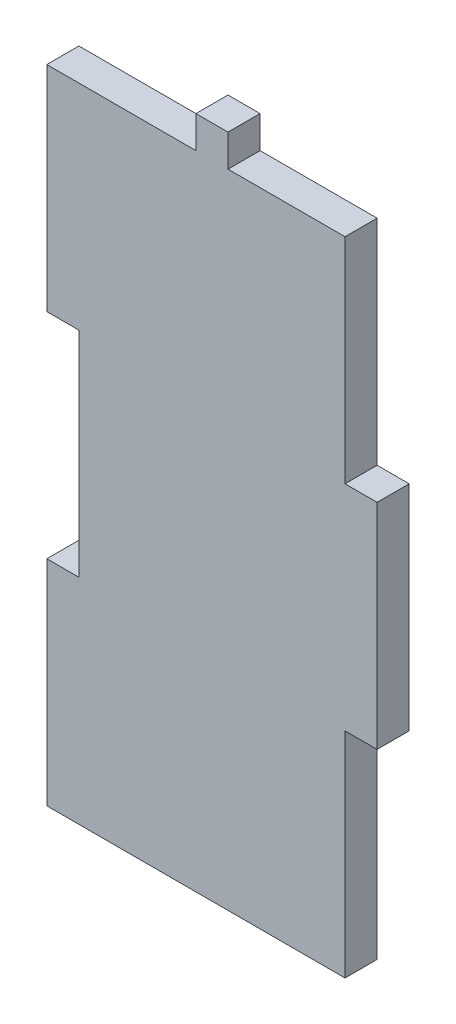
from build123d import *

# Parameters (mm, degrees)
PLATE_THICKNESS_3MM_DEPTH = 3
SKETCH_1_W                = 0.35
SKETCH_1_H                = 60
SKETCH_1_H_2              = 20
CUT_EXTRUDE_1_DEPTH       = 3


with BuildPart() as part:
    # Sketch1 → Plate_thickness_3mm (new body)
    with BuildSketch(Plane.XY):
        Polygon((28.57, 0), (0, 0), (0, 20), (3, 20), (3, 40), (0, 40), (0, 60), (14.285, 60), (14.285, 63), (17.285, 63), (17.285, 60), (28.57, 60), (28.57, 40), (31.57, 40), (31.57, 20), (28.57, 20), align=None)
    extrude(amount=PLATE_THICKNESS_3MM_DEPTH)

    # 草图1 → 切除-拉伸1 (cut)
    with BuildSketch(Plane.XY.offset(3)):
        with Locations((0.175, 30)):
            Rectangle(SKETCH_1_W, SKETCH_1_H)
        with Locations((3.175, 30)):
            Rectangle(SKETCH_1_W, SKETCH_1_H_2)
        with Locations((28.395, 50)):
            Rectangle(SKETCH_1_W, SKETCH_1_H_2)
        with Locations((31.395, 30)):
            Rectangle(SKETCH_1_W, SKETCH_1_H_2)
        with Locations((28.395, 10)):
            Rectangle(SKETCH_1_W, SKETCH_1_H_2)
    extrude(amount=-CUT_EXTRUDE_1_DEPTH, mode=Mode.SUBTRACT)


solid = part.part
